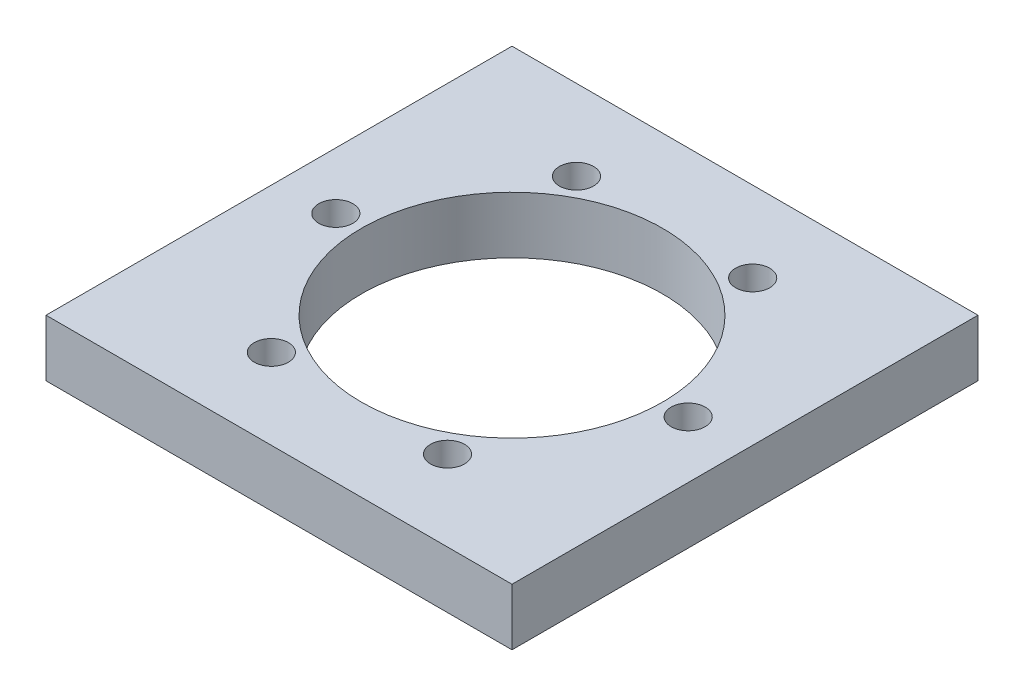
from build123d import *

# Parameters (mm, degrees)
SKETCH2_W           = 41
SKETCH2_H           = 41
SKETCH2_R           = 1.5
SKETCH2_R_2         = 13.25
BOSS_EXTRUDE1_DEPTH = 5


with BuildPart() as part:
    # Sketch2 → Boss-Extrude1 (new body)
    with BuildSketch(Plane(origin=(0, 0, 0), x_dir=(1, 0, 0), z_dir=(0, 1, 0))):
        Rectangle(SKETCH2_W, SKETCH2_H)
        with Locations(Location((15.5, 0, 0), (0, 0, 270))):
            Circle(SKETCH2_R, mode=Mode.SUBTRACT)
        with Locations(Location((7.75, -13.423393759, 0), (0, 0, 270))):
            Circle(SKETCH2_R, mode=Mode.SUBTRACT)
        with Locations(Location((-7.75, -13.423393759, 0), (0, 0, 270))):
            Circle(SKETCH2_R, mode=Mode.SUBTRACT)
        with Locations(Location((-15.5, 0, 0), (0, 0, 270))):
            Circle(SKETCH2_R, mode=Mode.SUBTRACT)
        with Locations(Location((-7.75, 13.423393759, 0), (0, 0, 270))):
            Circle(SKETCH2_R, mode=Mode.SUBTRACT)
        with Locations(Location((7.75, 13.423393759, 0), (0, 0, 270))):
            Circle(SKETCH2_R, mode=Mode.SUBTRACT)
        with Locations(Location((0, 0, 0), (0, 0, 270))):
            Circle(SKETCH2_R_2, mode=Mode.SUBTRACT)
    extrude(amount=BOSS_EXTRUDE1_DEPTH)


solid = part.part
